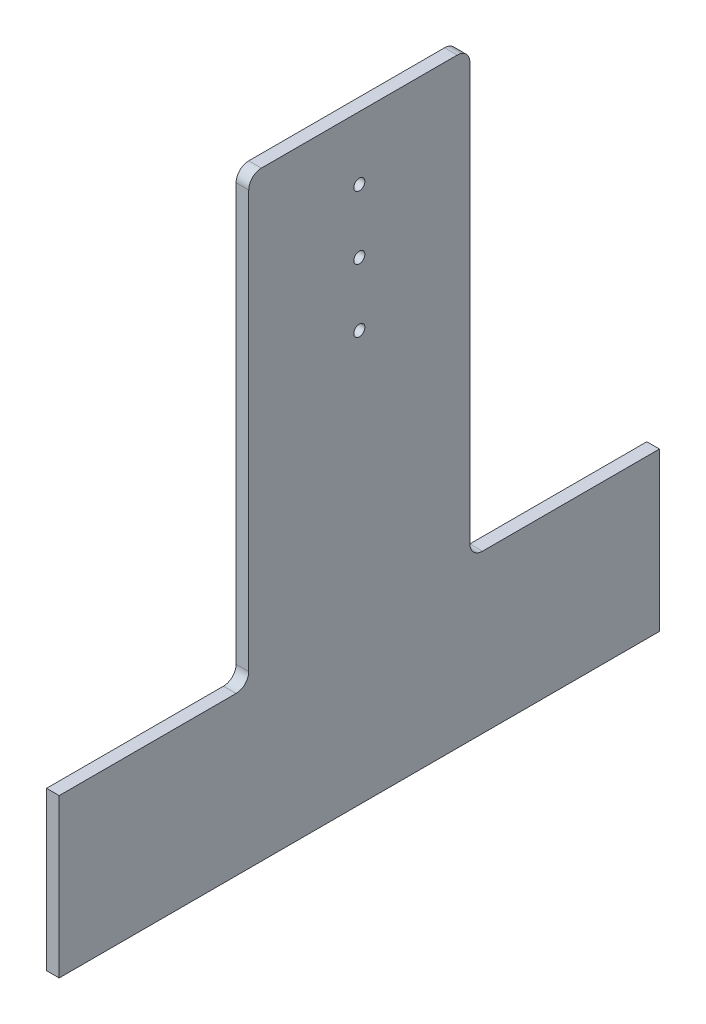
from build123d import *

# Parameters (mm, degrees)
SKETCH1_R           = 1.75
BOSS_EXTRUDE1_DEPTH = 4
FILLET1_R           = 4


with BuildPart() as part:
    # Sketch1 → Boss-Extrude1 (new body)
    with BuildSketch(Plane(origin=(0, 0, 0), x_dir=(0, 0, -1), z_dir=(1, 0, 0))):
        Polygon((35, 25), (95, 25), (95, -25), (-95, -25), (-95, 25), (-35, 25), (-35, 165), (35, 165), align=None)
        with Locations((0, 145)):
            Circle(SKETCH1_R, mode=Mode.SUBTRACT)
        with Locations((0, 125)):
            Circle(SKETCH1_R, mode=Mode.SUBTRACT)
        with Locations((0, 105)):
            Circle(SKETCH1_R, mode=Mode.SUBTRACT)
    extrude(amount=BOSS_EXTRUDE1_DEPTH)

    # Fillet1
    fillet1_edges = [part.edges().sort_by_distance(p)[0] for p in [
        (2, 25, 35),
        (2, 165, 35),
        (2, 165, -35),
        (2, 25, -35),
    ]]
    fillet(fillet1_edges, radius=FILLET1_R)


solid = part.part
